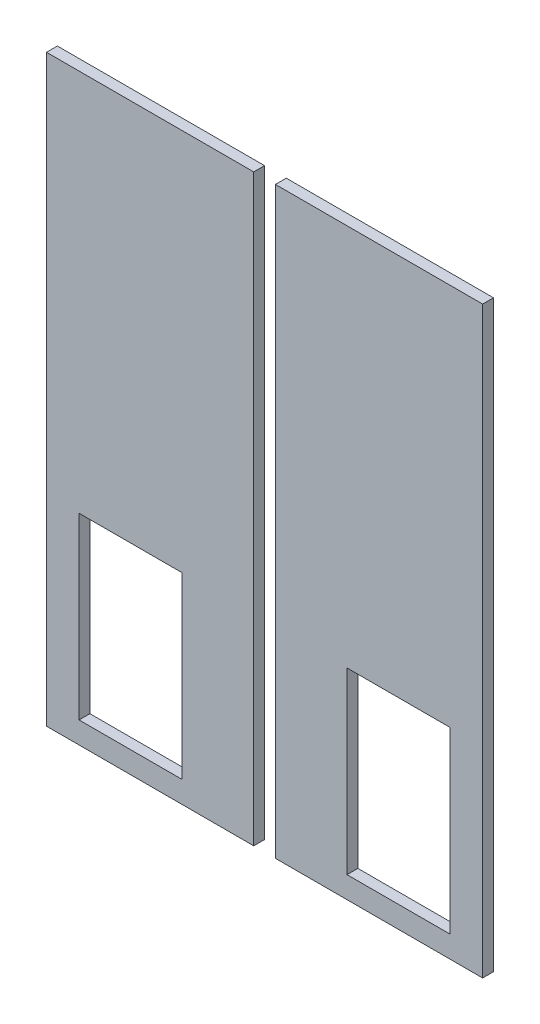
from build123d import *

# Parameters (mm, degrees)
SKETCH1_W             = 242.57
SKETCH1_H             = 683.26
SKETCH1_W_2           = 120.65
SKETCH1_H_2           = 209.55
BOSS_EXTRUDE1_DEPTH   = 12.7
BOSS_EXTRUDE1_2_DEPTH = 12.7


with BuildPart() as part:
    # Sketch1 → Boss-Extrude1 (new body)
    with BuildSketch(Plane.XY):
        with Locations((-133.985, 0)):
            Rectangle(SKETCH1_W, SKETCH1_H)
        with Locations((-156.845, -211.455)):
            Rectangle(SKETCH1_W_2, SKETCH1_H_2, mode=Mode.SUBTRACT)
    extrude(amount=BOSS_EXTRUDE1_DEPTH)


with BuildPart() as body_2:
    # Sketch1 → Boss-Extrude1 2 (new body)
    with BuildSketch(Plane.XY):
        with Locations((133.985, 0)):
            Rectangle(SKETCH1_W, SKETCH1_H)
        with Locations((156.845, -211.455)):
            Rectangle(SKETCH1_W_2, SKETCH1_H_2, mode=Mode.SUBTRACT)
    extrude(amount=BOSS_EXTRUDE1_2_DEPTH)


solid = Compound([part.part, body_2.part])
